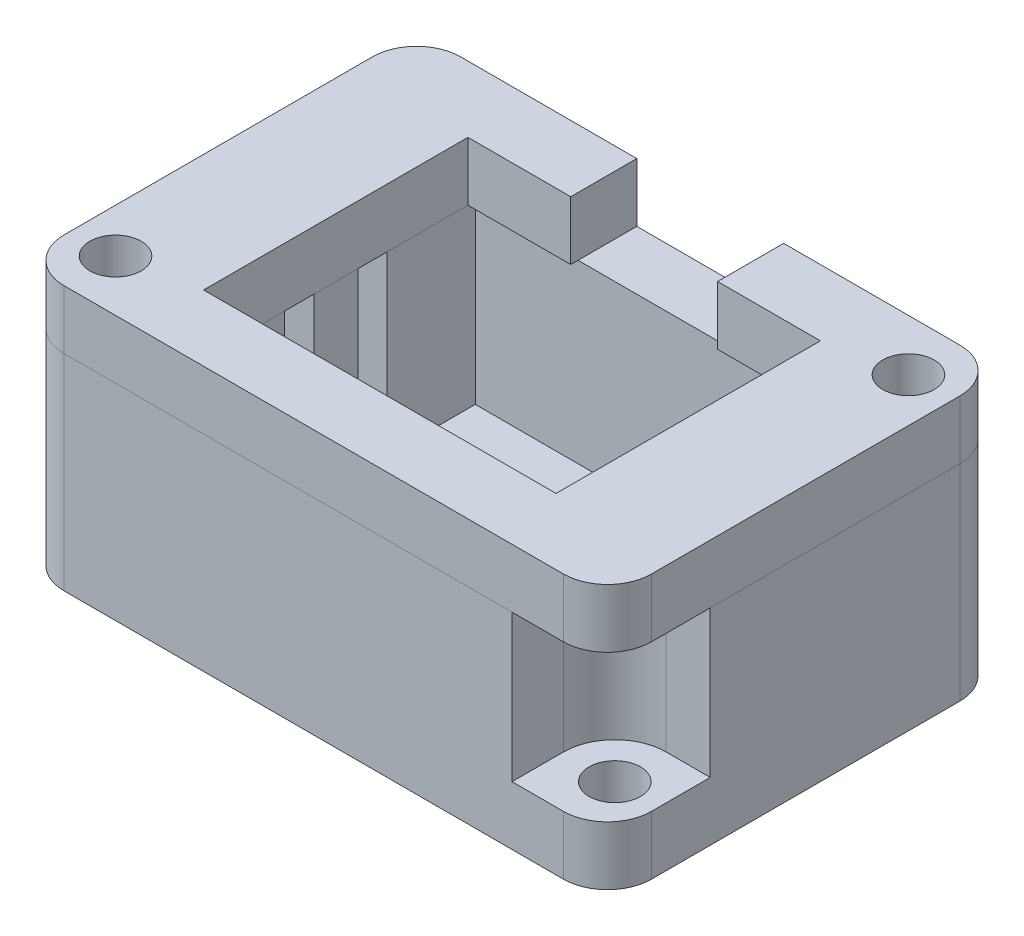
from build123d import *

# Parameters (mm, degrees)
SKETCH1_W           = 40
SKETCH1_H           = 27
BOSS_EXTRUDE1_DEPTH = 12
SKETCH2_W           = 40
SKETCH2_H           = 27
BOSS_EXTRUDE2_DEPTH = 2
SKETCH3_R           = 1.25
CUT_EXTRUDE1_DEPTH  = 28.897132469
FILLET1_R           = 3
SKETCH4_R           = 1.75
CUT_EXTRUDE2_DEPTH  = 28.897132469
CUT_EXTRUDE3_DEPTH  = 10
SKETCH6_R           = 1.75
BOSS_EXTRUDE3_DEPTH = 4


with BuildPart() as part:
    # Sketch1 → Boss-Extrude1 (new body)
    with BuildSketch(Plane(origin=(0, 0, 0), x_dir=(1, 0, 0), z_dir=(0, 1, 0))):
        Rectangle(SKETCH1_W, SKETCH1_H)
        Polygon((12, -3.5), (12, -9.5), (-12, -9.5), (-12, -3.5), (-16, -3.5), (-16, -1.5), (-12, -1.5), (-12, 1.5), (-16, 1.5), (-16, 3.5), (-12, 3.5), (-12, 9.5), (12, 9.5), (12, 3.5), (16, 3.5), (16, 1.5), (12, 1.5), (12, -1.5), (16, -1.5), (16, -3.5), align=None, mode=Mode.SUBTRACT)
    extrude(amount=BOSS_EXTRUDE1_DEPTH)

    # Sketch2 → Boss-Extrude2 (add)
    with BuildSketch(Plane.XZ):
        Rectangle(SKETCH2_W, SKETCH2_H)
    extrude(amount=BOSS_EXTRUDE2_DEPTH)

    # Sketch3 → Cut-Extrude1 (cut, through all)
    with BuildSketch(Plane(origin=(0, 12, 0), x_dir=(1, 0, 0), z_dir=(0, 1, 0))):
        with Locations(Location((-17, 10, 0), (0, 0, 270))):
            Circle(SKETCH3_R)
        with Locations(Location((17, 10, 0), (0, 0, 270))):
            Circle(SKETCH3_R)
        with Locations(Location((17, -10, 0), (0, 0, 270))):
            Circle(SKETCH3_R)
        with Locations(Location((-17, -10, 0), (0, 0, 270))):
            Circle(SKETCH3_R)
    extrude(amount=-CUT_EXTRUDE1_DEPTH, mode=Mode.SUBTRACT)

    # Fillet1
    fillet1_edges = [part.edges().sort_by_distance(p)[0] for p in [
        (-20, 5, -13.5),
        (20, 5, -13.5),
        (20, 5, 13.5),
        (-20, 5, 13.5),
    ]]
    fillet(fillet1_edges, radius=FILLET1_R)

    # Sketch4 → Cut-Extrude2 (cut, through all)
    with BuildSketch(Plane(origin=(0, 12, 0), x_dir=(1, 0, 0), z_dir=(0, 1, 0))):
        with Locations(Location((-17, 10, 0), (0, 0, 270))):
            Circle(SKETCH4_R)
        with Locations(Location((17, -10, 0), (0, 0, 270))):
            Circle(SKETCH4_R)
    extrude(amount=-CUT_EXTRUDE2_DEPTH, mode=Mode.SUBTRACT)

    # Sketch5 → Cut-Extrude3 (cut)
    with BuildSketch(Plane(origin=(0, 12, 0), x_dir=(1, 0, 0), z_dir=(0, 1, 0))):
        with BuildLine():
            Line((-17, 6.5), (-20, 6.5))
            Line((-20, 6.5), (-20, 13.5))
            Line((-20, 13.5), (-13.5, 13.5))
            Line((-13.5, 13.5), (-13.5, 10))
            ThreePointArc((-13.5, 10), (-14.525126266, 7.525126266), (-17, 6.5))
        make_face()
        with BuildLine():
            Line((17, -6.5), (20, -6.5))
            Line((20, -6.5), (20, -13.5))
            Line((20, -13.5), (13.5, -13.5))
            Line((13.5, -13.5), (13.5, -10))
            ThreePointArc((13.5, -10), (14.525126266, -7.525126266), (17, -6.5))
        make_face()
    extrude(amount=-CUT_EXTRUDE3_DEPTH, mode=Mode.SUBTRACT)


with BuildPart() as body_2:
    # Sketch6 → Boss-Extrude3 (new body)
    with BuildSketch(Plane(origin=(0, 12, 0), x_dir=(1, 0, 0), z_dir=(0, 1, 0))):
        with BuildLine():
            Line((-5, 13.5), (-5, 9))
            Line((-5, 9), (-12, 9))
            Line((-12, 9), (-12, -9))
            Line((-12, -9), (12, -9))
            Line((12, -9), (12, 9))
            Line((12, 9), (5, 9))
            Line((5, 9), (5, 13.5))
            Line((5, 13.5), (17, 13.5))
            ThreePointArc((17, 13.5), (19.121320344, 12.621320344), (20, 10.5))
            Line((20, 10.5), (20, -10.5))
            ThreePointArc((20, -10.5), (19.121320344, -12.621320344), (17, -13.5))
            Line((17, -13.5), (-17, -13.5))
            ThreePointArc((-17, -13.5), (-19.121320344, -12.621320344), (-20, -10.5))
            Line((-20, -10.5), (-20, 10.5))
            ThreePointArc((-20, 10.5), (-19.121320344, 12.621320344), (-17, 13.5))
            Line((-17, 13.5), (-5, 13.5))
        make_face()
        with Locations(Location((-17, -10, 0), (0, 0, 270))):
            Circle(SKETCH6_R, mode=Mode.SUBTRACT)
        with Locations(Location((17, 10, 0), (0, 0, 270))):
            Circle(SKETCH6_R, mode=Mode.SUBTRACT)
    extrude(amount=BOSS_EXTRUDE3_DEPTH)


solid = Compound([part.part, body_2.part])
